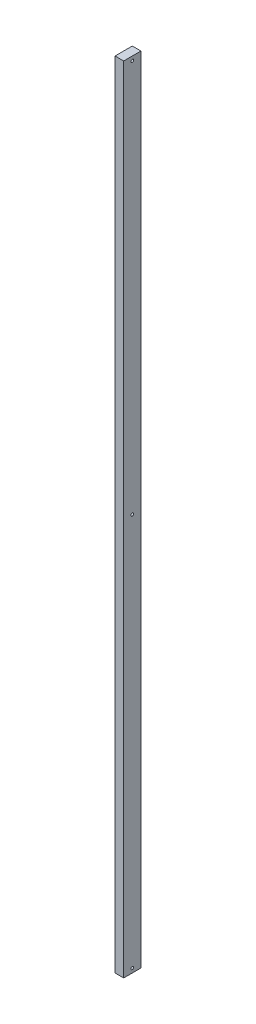
from build123d import *

# Parameters (mm, degrees)
SKETCH_1_W          = 25
SKETCH_1_H          = 50
EXTRUDE_1_DEPTH     = 2300
SKETCH_2_R          = 4
CUT_EXTRUDE_1_DEPTH = 2300


with BuildPart() as part:
    # Эскиз1 → Бобышка-Вытянуть1 (new body)
    with BuildSketch(Plane(origin=(0, 0, 0), x_dir=(1, 0, 0), z_dir=(0, 1, 0))):
        Rectangle(SKETCH_1_W, SKETCH_1_H)
    extrude(amount=EXTRUDE_1_DEPTH)

    # Эскиз2 → Вырез-Вытянуть1 (cut)
    with BuildSketch(Plane(origin=(12.5, 0, 0), x_dir=(0, 0, -1), z_dir=(1, 0, 0))):
        with Locations((0, 1150)):
            Circle(SKETCH_2_R)
        with Locations((0, 2287.5)):
            Circle(SKETCH_2_R)
        with Locations((0, 12.5)):
            Circle(SKETCH_2_R)
    extrude(amount=-CUT_EXTRUDE_1_DEPTH, mode=Mode.SUBTRACT)


solid = part.part
